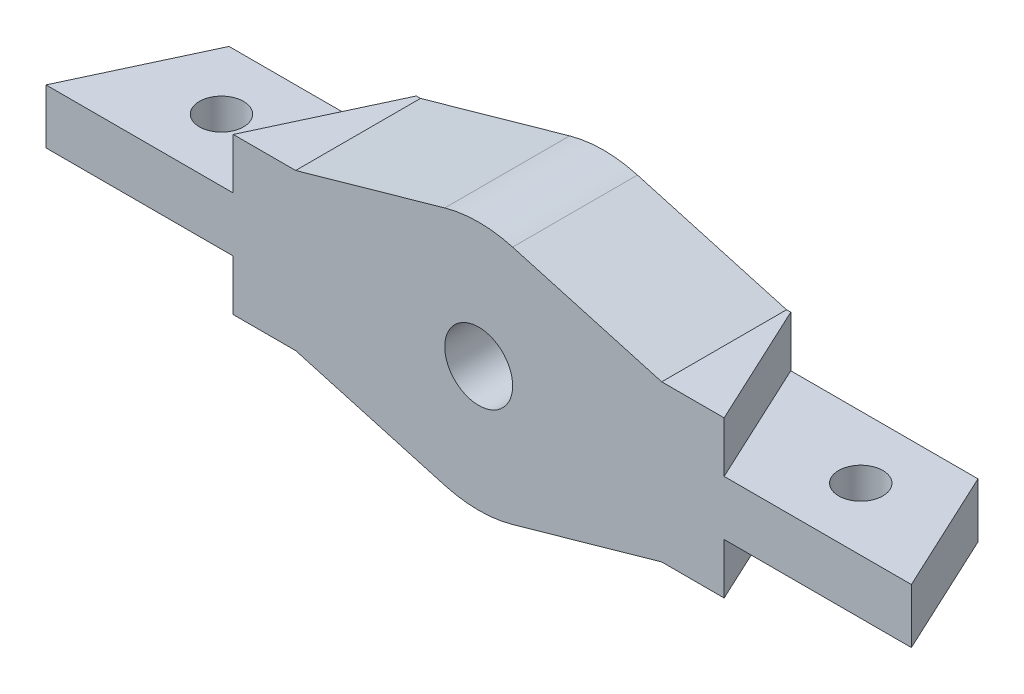
from build123d import *

# Parameters (mm, degrees)
BOSS_EXTRUDE1_DEPTH                      = 12.7
SKETCH5_R                                = 3.4544
CUT_EXTRUDE2_DEPTH                       = 31.760138832
SKETCH6_W                                = 19.05
SKETCH6_H                                = 5.55625
SKETCH7_W                                = 19.05
SKETCH7_H                                = 5.55625
CUT_EXTRUDE3_REACH                       = 49.094
SKETCH8_R                                = 2.2479
CUT_EXTRUDE4_DEPTH                       = 48.544988458
MIRROR1_AT_THE_SECOND_PLANE_COPY_1_DEPTH = 48.544988458


with BuildPart() as part:
    # Sketch2 → Boss-Extrude1 (new, symmetric)
    with BuildSketch(Plane(origin=(0, 0, 0), x_dir=(1, 0, 0), z_dir=(0, 1, 0))):
        Polygon((-19.05, 6.35), (19.05, 6.35), (24.972107259, -6.35), (-24.972107259, -6.35), align=None)
    extrude(amount=BOSS_EXTRUDE1_DEPTH, both=True)

    # Sketch5 → Cut-Extrude2 (cut, through all)
    with BuildSketch(Plane.XY.offset(6.35)):
        Circle(SKETCH5_R)
    extrude(amount=-CUT_EXTRUDE2_DEPTH, mode=Mode.SUBTRACT)

    # Sweep1: sweep along a curve in space
    with BuildLine() as sweep1_path:
        Line((-19.05, 12.7, -6.35), (-24.972107259, 12.7, 6.35))
    # Sketch6 → Sweep1 (sweep)
    with BuildSketch(Plane.XY.offset(6.35)):
        with Locations((-34.497107259, 0)):
            Rectangle(SKETCH6_W, SKETCH6_H)
    sweep(path=sweep1_path.line)

    # Sweep2: sweep along a curve in space
    with BuildLine() as sweep2_path:
        Line((24.972107259, 12.7, 6.35), (19.05, 12.7, -6.35))
    # Sketch7 → Sweep2 (sweep)
    with BuildSketch(Plane.XY.offset(6.35)):
        with Locations((34.497107259, 0)):
            Rectangle(SKETCH7_W, SKETCH7_H)
    sweep(path=sweep2_path.line)

    # Sketch8 → Cut-Extrude3 (cut, up to next)
    with BuildSketch(Plane(origin=(0, 2.778125, 0), x_dir=(1, 0, 0), z_dir=(0, 1, 0)), mode=Mode.PRIVATE) as cut_extrude3_sk1:
        with Locations(Location((-32.520728307, 0, 0), (0, 0, 180))):
            Circle(SKETCH8_R)
    cut_extrude3_tool1 = extrude(cut_extrude3_sk1.sketch, amount=-CUT_EXTRUDE3_REACH, mode=Mode.PRIVATE) & part.part
    # Sketch8 → Cut-Extrude3 (cut, up to next)
    with BuildSketch(Plane(origin=(0, 2.778125, 0), x_dir=(1, 0, 0), z_dir=(0, 1, 0)), mode=Mode.PRIVATE) as cut_extrude3_sk2:
        with Locations(Location((32.520728307, 0, 0), (0, 0, 180))):
            Circle(SKETCH8_R)
    cut_extrude3_tool2 = extrude(cut_extrude3_sk2.sketch, amount=-CUT_EXTRUDE3_REACH, mode=Mode.PRIVATE) & part.part
    add(cut_extrude3_tool1.solids().sort_by_distance((-32.520728, 2.778125, 0))[0], mode=Mode.SUBTRACT)
    add(cut_extrude3_tool2.solids().sort_by_distance((32.520728, 2.778125, 0))[0], mode=Mode.SUBTRACT)

    # Sketch9 → Cut-Extrude4 (cut, through all)
    with BuildSketch(Plane.XY.offset(6.35)):
        with BuildLine():
            Line((-24.972107259, 12.7), (-24.972107259, 7.9375))
            Line((-24.972107259, 7.9375), (-18.622107259, 7.9375))
            Line((-18.622107259, 7.9375), (-3.451726858, 12.221930359))
            ThreePointArc((-3.451726858, 12.221930359), (-1.742338148, 12.579914856), (0, 12.7))
            Line((0, 12.7), (-24.972107259, 12.7))
        make_face()
    cut_extrude4 = extrude(amount=-CUT_EXTRUDE4_DEPTH, mode=Mode.SUBTRACT)

    # Mirror1: Cut-Extrude4 across plane
    add(cut_extrude4.mirror(Plane(origin=(0, 0, 0), x_dir=(0, 0, 1), z_dir=(1, 0, 0))), mode=Mode.SUBTRACT)

    # Mirror1 at the second plane: Cut-Extrude4 across plane
    add(cut_extrude4.mirror(Plane.ZX), mode=Mode.SUBTRACT)

    # Mirror1 at the second plane copy 1 sketc → Mirror1 at the second plane copy 1 (cut, through all)
    with BuildSketch(Plane(origin=(0, 0, 6.35), x_dir=(-1, 0, 0), z_dir=(0, 0, 1))):
        with BuildLine():
            Line((-24.972107259, 12.7), (-24.972107259, 7.9375))
            Line((-24.972107259, 7.9375), (-18.622107259, 7.9375))
            Line((-18.622107259, 7.9375), (-3.451726858, 12.221930359))
            ThreePointArc((-3.451726858, 12.221930359), (-1.742338148, 12.579914856), (0, 12.7))
            Line((0, 12.7), (-24.972107259, 12.7))
        make_face()
    extrude(amount=-MIRROR1_AT_THE_SECOND_PLANE_COPY_1_DEPTH, mode=Mode.SUBTRACT)


solid = part.part
